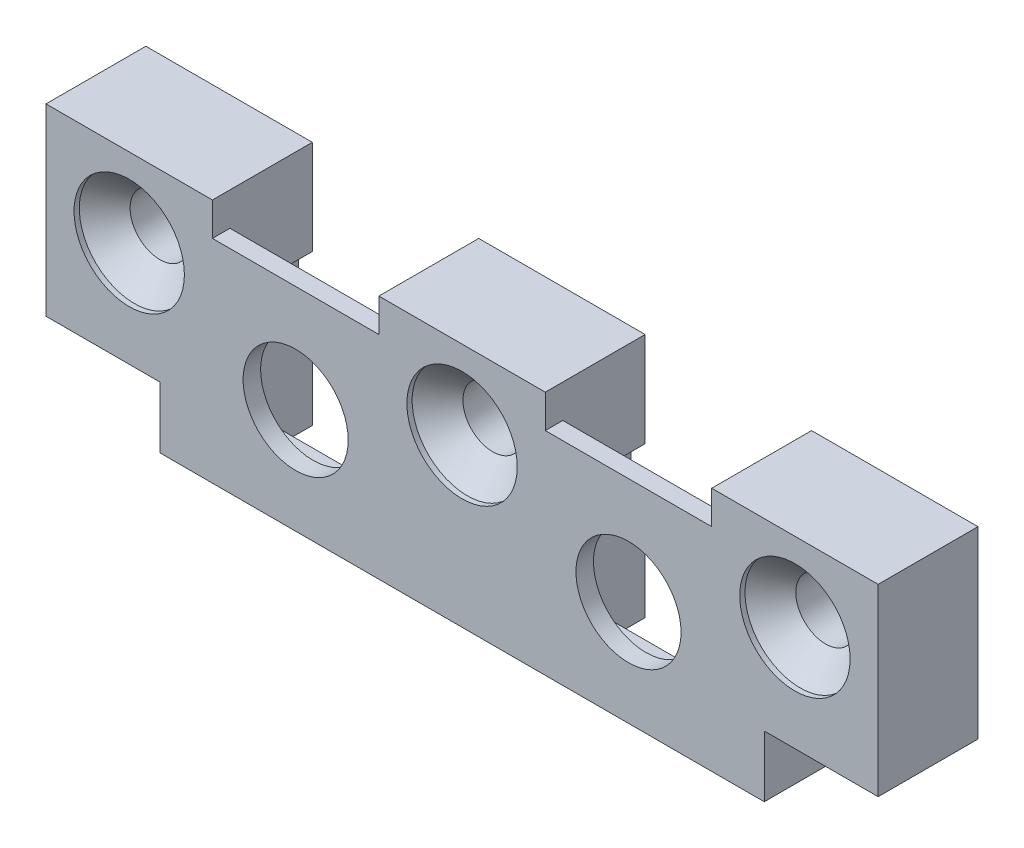
from build123d import *

# Parameters (mm, degrees)
SKETCH1_R                                    = 1.5
BOSS_EXTRUDE1_DEPTH                          = 1.2
BOSS_EXTRUDE1_2_DEPTH                        = 1.2
BOSS_EXTRUDE1_3_DEPTH                        = 1.2
SKETCH2_R                                    = 1.5
BOSS_EXTRUDE2_DEPTH                          = 3.5
SKETCH3_R                                    = 1.5
BOSS_EXTRUDE3_DEPTH                          = 1
CSK_FOR_M3_COUNTERSUNK_FLAT_HEAD_SCR_2_COUNT = 2
CSK_FOR_M3_COUNTERSUNK_FLAT_HEAD_SCR_2_PITCH = 19
CSK_FOR_M3_COUNTERSUNK_FLAT_HEAD_SCR_3_COUNT = 2
CSK_FOR_M3_COUNTERSUNK_FLAT_HEAD_SCR_3_PITCH = 38
SKETCH7_R                                    = 3
CUT_EXTRUDE1_DEPTH                           = 67.004185473
SKETCH8_W                                    = 6.5
SKETCH8_H                                    = 3.5
CUT_EXTRUDE2_DEPTH                           = 67.004185473
SKETCH10_W                                   = 9.5
SKETCH10_H                                   = 1.1
CUT_EXTRUDE3_DEPTH                           = 1


with BuildPart() as part:
    # Sketch1 → Boss-Extrude1 (new body)
    with BuildSketch(Plane.XY):
        Polygon((-55.55, 8.6), (-54.75, 8.6), (-54.75, 14), (-64.25, 14), (-64.25, 0), (-54.75, 0), (-54.75, 4.6), (-55.55, 4.6), align=None)
        with Locations((-59.5, 9.5)):
            Circle(SKETCH1_R, mode=Mode.SUBTRACT)
    extrude(amount=BOSS_EXTRUDE1_DEPTH)



with BuildPart() as body_2:
    # Sketch1 → Boss-Extrude1 2 (new body)
    with BuildSketch(Plane.XY):
        Polygon((-45.25, 4.6), (-45.25, 0), (-35.75, 0), (-35.75, 4.6), (-36.55, 4.6), (-36.55, 8.6), (-35.75, 8.6), (-35.75, 14), (-45.25, 14), (-45.25, 8.6), (-44.45, 8.6), (-44.45, 4.6), align=None)
        with Locations((-40.5, 9.5)):
            Circle(SKETCH1_R, mode=Mode.SUBTRACT)
    extrude(amount=BOSS_EXTRUDE1_2_DEPTH)


with BuildPart() as body_3:
    # Sketch1 → Boss-Extrude1 3 (new body)
    with BuildSketch(Plane.XY):
        Polygon((-26.25, 4.6), (-26.25, 0), (-16.75, 0), (-16.75, 14), (-26.25, 14), (-26.25, 8.6), (-25.45, 8.6), (-25.45, 4.6), align=None)
        with Locations((-21.5, 9.5)):
            Circle(SKETCH1_R, mode=Mode.SUBTRACT)
    extrude(amount=BOSS_EXTRUDE1_3_DEPTH)


with BuildPart() as part_1:
    add(part.part)

    add(body_2.part)  # Boss-Extrude2 merges body 2

    add(body_3.part)  # Boss-Extrude2 merges body 3
    # Sketch2 → Boss-Extrude2 (add)
    with BuildSketch(Plane.XY.offset(1.2)):
        Polygon((-54.75, 14), (-64.25, 14), (-64.25, 0), (-16.75, 0), (-16.75, 14), (-26.25, 14), (-26.25, 1.1), (-35.75, 1.1), (-35.75, 14), (-45.25, 14), (-45.25, 1.1), (-54.75, 1.1), align=None)
        with Locations((-59.5, 9.5)):
            Circle(SKETCH2_R, mode=Mode.SUBTRACT)
        with Locations((-40.5, 9.5)):
            Circle(SKETCH2_R, mode=Mode.SUBTRACT)
        with Locations((-21.5, 9.5)):
            Circle(SKETCH2_R, mode=Mode.SUBTRACT)
    extrude(amount=BOSS_EXTRUDE2_DEPTH)

    # Sketch3 → Boss-Extrude3 (add)
    with BuildSketch(Plane.XY.offset(4.7)):
        Polygon((-64.25, 14), (-54.75, 14), (-54.75, 12.1), (-45.25, 12.1), (-45.25, 14), (-35.75, 14), (-35.75, 12.1), (-26.25, 12.1), (-26.25, 14), (-16.75, 14), (-16.75, 0), (-64.25, 0), align=None)
        with Locations((-59.5, 9.5)):
            Circle(SKETCH3_R, mode=Mode.SUBTRACT)
        with Locations((-40.5, 9.5)):
            Circle(SKETCH3_R, mode=Mode.SUBTRACT)
        with Locations((-21.5, 9.5)):
            Circle(SKETCH3_R, mode=Mode.SUBTRACT)
    extrude(amount=BOSS_EXTRUDE3_DEPTH)

    # Sketch6 → CSK for M3 Countersunk Flat Head Screw1 (revolve, cut)
    with BuildSketch(Plane(origin=(-59.5, 9.5, 5.7), x_dir=(0, -1, 0), z_dir=(1, 0, 0))):
        Polygon((0, 0), (0, 5.7), (1.7, 5.7), (1.7, 1.75), (3.15, 0.3), (3.15, 0), align=None)
    csk_for_m3_countersunk_flat_head_screw1 = revolve(axis=Axis((-59.5, 9.5, 12.05), (0, 0, -1)), mode=Mode.SUBTRACT)

    # CSK for M3 Countersunk Flat Head Scr 2: CSK for M3 Countersunk Flat Head Screw1 ×2
    with Locations(*[(i * CSK_FOR_M3_COUNTERSUNK_FLAT_HEAD_SCR_2_PITCH, 0, 0) for i in range(1, CSK_FOR_M3_COUNTERSUNK_FLAT_HEAD_SCR_2_COUNT)]):
        add(csk_for_m3_countersunk_flat_head_screw1, mode=Mode.SUBTRACT)

    # CSK for M3 Countersunk Flat Head Scr 3: CSK for M3 Countersunk Flat Head Screw1 ×2
    with Locations(*[(i * CSK_FOR_M3_COUNTERSUNK_FLAT_HEAD_SCR_3_PITCH, 0, 0) for i in range(1, CSK_FOR_M3_COUNTERSUNK_FLAT_HEAD_SCR_3_COUNT)]):
        add(csk_for_m3_countersunk_flat_head_screw1, mode=Mode.SUBTRACT)

    # Sketch7 → Cut-Extrude1 (cut, through all)
    with BuildSketch(Plane.XY.offset(5.7)):
        with Locations((-50, 6)):
            Circle(SKETCH7_R)
        with Locations((-31, 6)):
            Circle(SKETCH7_R)
    extrude(amount=-CUT_EXTRUDE1_DEPTH, mode=Mode.SUBTRACT)

    # Sketch8 → Cut-Extrude2 (cut, through all)
    with BuildSketch(Plane.XY.offset(5.7)):
        with Locations((-61, 1.75)):
            Rectangle(SKETCH8_W, SKETCH8_H)
        with Locations((-20, 1.75)):
            Rectangle(SKETCH8_W, SKETCH8_H)
    extrude(amount=-CUT_EXTRUDE2_DEPTH, mode=Mode.SUBTRACT)

    # Sketch10 → Cut-Extrude3 (cut)
    with BuildSketch(Plane(origin=(0, 0, 1.2), x_dir=(-1, 0, 0), z_dir=(0, 0, -1))):
        with Locations((31, 0.55)):
            Rectangle(SKETCH10_W, SKETCH10_H)
        with Locations((50, 0.55)):
            Rectangle(SKETCH10_W, SKETCH10_H)
    extrude(amount=-CUT_EXTRUDE3_DEPTH, mode=Mode.SUBTRACT)


solid = part_1.part
